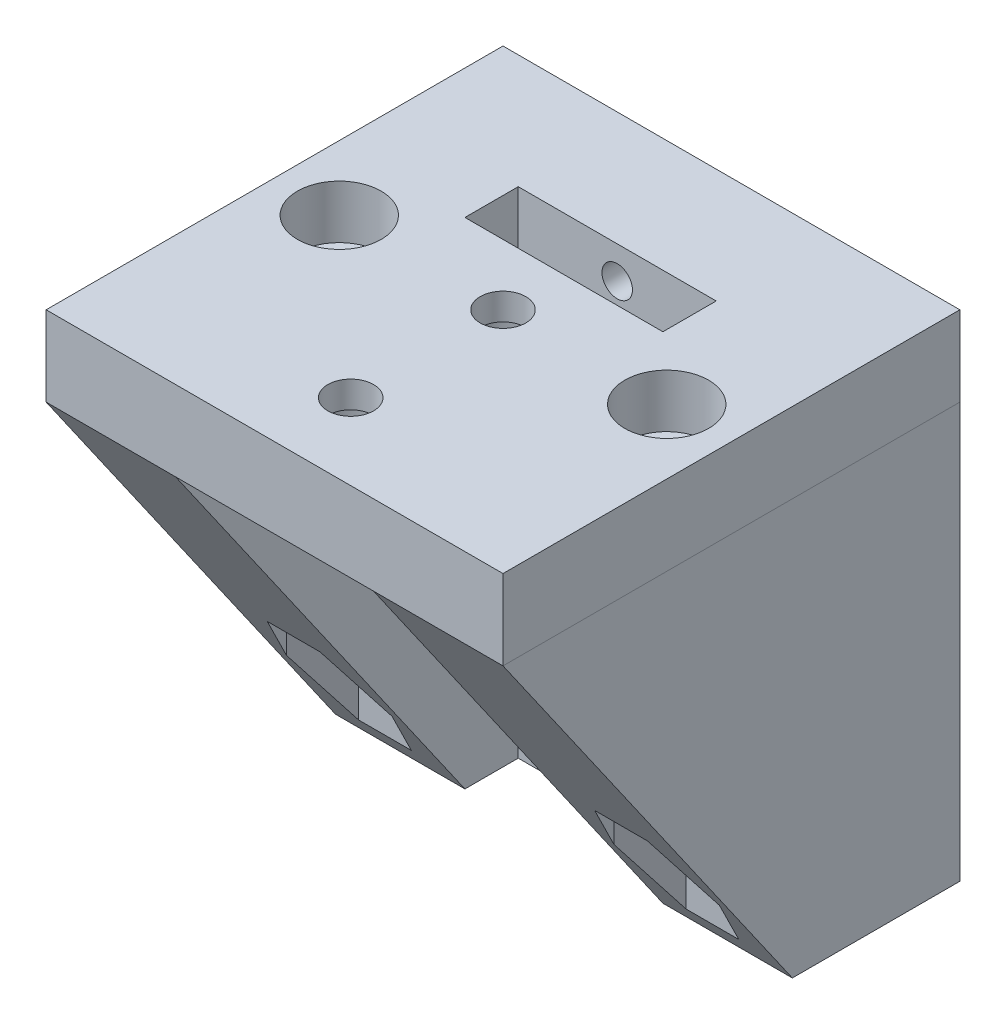
from build123d import *

# Parameters (mm, degrees)
SKETCH1_W           = 30
SKETCH1_H           = 32.5
SKETCH1_R           = 1
SKETCH1_W_2         = 13
SKETCH1_H_2         = 23
BOSS_EXTRUDE3_DEPTH = 1.5
SKETCH6_W           = 30
SKETCH6_H           = 32.5
BOSS_EXTRUDE4_DEPTH = 6
CUT_EXTRUDE1_DEPTH  = 6
SKETCH7_W           = 8.5
SKETCH7_H           = 32.5
BOSS_EXTRUDE5_DEPTH = 3.5
SKETCH8_W           = 30
SKETCH8_H           = 5.25
BOSS_EXTRUDE6_DEPTH = 19
BOSS_EXTRUDE7_DEPTH = 8.5
BOSS_EXTRUDE8_DEPTH = 8.5
CUT_EXTRUDE2_DEPTH  = 1.5
CUT_EXTRUDE3_START  = -4.5
SKETCH14_R          = 1
CUT_EXTRUDE3_DEPTH  = 4.5
CHAMFER2_SIZE       = 1.1
SKETCH15_R          = 2.75
CUT_EXTRUDE4_DEPTH  = 3.5
SKETCH16_R          = 1.5
CUT_EXTRUDE5_DEPTH  = 1.75
CUT_EXTRUDE6_REACH  = 35.145
SKETCH20_R          = 1.5
CUT_EXTRUDE7_DEPTH  = 15.25
SKETCH21_R          = 2.75
CUT_EXTRUDE8_DEPTH  = 3.5


with BuildPart() as part:
    # Sketch1 → Boss-Extrude3 (new body)
    with BuildSketch(Plane.XY):
        with Locations((0, 5.65)):
            Rectangle(SKETCH1_W, SKETCH1_H)
        with Locations((0, -8.475)):
            Circle(SKETCH1_R, mode=Mode.SUBTRACT)
        with Locations((0, 19.775)):
            Circle(SKETCH1_R, mode=Mode.SUBTRACT)
        with Locations((0, 5.15)):
            Rectangle(SKETCH1_W_2, SKETCH1_H_2, mode=Mode.SUBTRACT)
    extrude(amount=BOSS_EXTRUDE3_DEPTH)

    # Sketch6 → Boss-Extrude4 (add)
    with BuildSketch(Plane(origin=(0, 0, 0), x_dir=(-1, 0, 0), z_dir=(0, 0, -1))):
        with Locations((0, 5.65)):
            Rectangle(SKETCH6_W, SKETCH6_H)
    extrude(amount=BOSS_EXTRUDE4_DEPTH)

    # Sketch1<3> → Cut-Extrude1 (cut)
    with BuildSketch(Plane.XY):
        with BuildLine():
            Line((3.5, 6.35), (3.5, 5.298348799))
            ThreePointArc((3.5, 5.298348799), (0, -6.35), (-3.5, 5.298348799))
            Line((-3.5, 5.298348799), (-3.5, 6.35))
            ThreePointArc((-3.5, 6.35), (0, 9.85), (3.5, 6.35))
        make_face()
    extrude(amount=-CUT_EXTRUDE1_DEPTH, mode=Mode.SUBTRACT)

    # Sketch7 → Boss-Extrude5 (add)
    with BuildSketch(Plane.XY.offset(1.5)):
        with Locations((-10.75, 5.65)):
            Rectangle(SKETCH7_W, SKETCH7_H)
        with Locations((10.75, 5.65)):
            Rectangle(SKETCH7_W, SKETCH7_H)
    extrude(amount=BOSS_EXTRUDE5_DEPTH)

    # Sketch8 → Boss-Extrude6 (add)
    with BuildSketch(Plane.XY.offset(5)):
        with Locations((0, 19.275)):
            Rectangle(SKETCH8_W, SKETCH8_H)
    extrude(amount=BOSS_EXTRUDE6_DEPTH)

    # Sketch9 → Boss-Extrude7 (add)
    with BuildSketch(Plane(origin=(15, 0, 0), x_dir=(0, 0, -1), z_dir=(1, 0, 0))):
        Polygon((-24, 16.65), (-5, 16.65), (-5, -10.6), align=None)
    extrude(amount=-BOSS_EXTRUDE7_DEPTH)

    # Sketch10 → Boss-Extrude8 (add)
    with BuildSketch(Plane.ZY.offset(15)):
        Polygon((24, 16.65), (5, -10.6), (5, 16.65), align=None)
    extrude(amount=-BOSS_EXTRUDE8_DEPTH)

    # Sketch12 → Cut-Extrude2 (cut)
    with BuildSketch(Plane(origin=(0, 0, -6), x_dir=(-1, 0, 0), z_dir=(0, 0, -1))):
        Polygon((2.309401077, -8.6), (1.154700538, -6.6), (-1.154700538, -6.6), (-2.309401077, -8.6), (-1.154700538, -10.6), (1.154700538, -10.6), align=None)
    extrude(amount=-CUT_EXTRUDE2_DEPTH, mode=Mode.SUBTRACT)

    # Sketch14 → Cut-Extrude3 (cut)
    with BuildSketch(Plane.XY.offset(CUT_EXTRUDE3_START)):
        with Locations(Location((0, -8.475, 0), (0, 0, 180))):
            Circle(SKETCH14_R)
    extrude(amount=CUT_EXTRUDE3_DEPTH, mode=Mode.SUBTRACT)

    # Chamfer2
    chamfer2_edges = [part.edges().sort_by_distance(p)[0] for p in [
        (0, -6.35, 1.5),
    ]]
    chamfer(chamfer2_edges, length=CHAMFER2_SIZE)

    # Sketch15 → Cut-Extrude4 (cut)
    with BuildSketch(Plane.XZ.offset(-16.65)):
        with Locations(Location((0, 19, 0), (0, 0, 270))):
            Circle(SKETCH15_R)
        with Locations(Location((0, 9, 0), (0, 0, 270))):
            Circle(SKETCH15_R)
    extrude(amount=-CUT_EXTRUDE4_DEPTH, mode=Mode.SUBTRACT)

    # Sketch16 → Cut-Extrude5 (cut)
    with BuildSketch(Plane.XZ.offset(-20.15)):
        with Locations(Location((0, 19, 0), (0, 0, 270))):
            Circle(SKETCH16_R)
        with Locations(Location((0, 9, 0), (0, 0, 270))):
            Circle(SKETCH16_R)
    extrude(amount=-CUT_EXTRUDE5_DEPTH, mode=Mode.SUBTRACT)

    # Cut-Extrude6: up to this plane
    cut_extrude6_end = Plane(origin=(-26.719911198, -10.6, 5), z_dir=(0, -0.5719461405775754, 0.8202911753020488))
    # Sketch19 → Cut-Extrude6 (cut, up to the surface)
    with BuildSketch(Plane(origin=(0, 6.65, 0), x_dir=(-1, 0, 0), z_dir=(0, -1, 0)), mode=Mode.PRIVATE) as cut_extrude6_sk1:
        Polygon((9.017949192, -12), (7.285898385, -9), (9.017949192, -6), (12.482050808, -6), (14.214101615, -9), (12.482050808, -12), align=None)
    cut_extrude6_tool1 = split(extrude(cut_extrude6_sk1.sketch, amount=CUT_EXTRUDE6_REACH, mode=Mode.PRIVATE), bisect_by=cut_extrude6_end, keep=Keep.BOTH, mode=Mode.PRIVATE)
    add(cut_extrude6_tool1.solids().sort_by_distance((-10.75, 6.65, 9))[0], mode=Mode.SUBTRACT)
    # Sketch19 → Cut-Extrude6 (cut, up to the surface)
    with BuildSketch(Plane(origin=(0, 6.65, 0), x_dir=(-1, 0, 0), z_dir=(0, -1, 0)), mode=Mode.PRIVATE) as cut_extrude6_sk2:
        Polygon((-7.285898385, -9), (-9.017949192, -6), (-12.482050808, -6), (-14.214101615, -9), (-12.482050808, -12), (-9.017949192, -12), align=None)
    cut_extrude6_tool2 = split(extrude(cut_extrude6_sk2.sketch, amount=CUT_EXTRUDE6_REACH, mode=Mode.PRIVATE), bisect_by=cut_extrude6_end, keep=Keep.BOTH, mode=Mode.PRIVATE)
    add(cut_extrude6_tool2.solids().sort_by_distance((10.75, 6.65, 9))[0], mode=Mode.SUBTRACT)

    # Sketch20 → Cut-Extrude7 (cut)
    with BuildSketch(Plane.XZ.offset(-6.65)):
        with Locations(Location((-10.75, 9, 0), (0, 0, 270))):
            Circle(SKETCH20_R)
        with Locations(Location((10.75, 9, 0), (0, 0, 90))):
            Circle(SKETCH20_R)
    extrude(amount=-CUT_EXTRUDE7_DEPTH, mode=Mode.SUBTRACT)

    # Sketch21 → Cut-Extrude8 (cut)
    with BuildSketch(Plane(origin=(0, 21.9, 0), x_dir=(1, 0, 0), z_dir=(0, 1, 0))):
        with Locations(Location((-10.75, -9, 0), (0, 0, 270))):
            Circle(SKETCH21_R)
        with Locations(Location((10.75, -9, 0), (0, 0, 90))):
            Circle(SKETCH21_R)
    extrude(amount=-CUT_EXTRUDE8_DEPTH, mode=Mode.SUBTRACT)


with BuildPart() as body_2:
    # Split1: the piece on the far side of the plane
    add(part.part)
    split(bisect_by=Plane(origin=(0, 16.65, 0), x_dir=(0, 0, -1), z_dir=(0, -1, 0)), keep=Keep.BOTTOM)


with BuildPart() as part_1:
    add(part.part)

    # Split1
    split(bisect_by=Plane(origin=(0, 16.65, 0), x_dir=(0, 0, -1), z_dir=(0, -1, 0)), keep=Keep.TOP)


solid = Compound([body_2.part, part_1.part])
